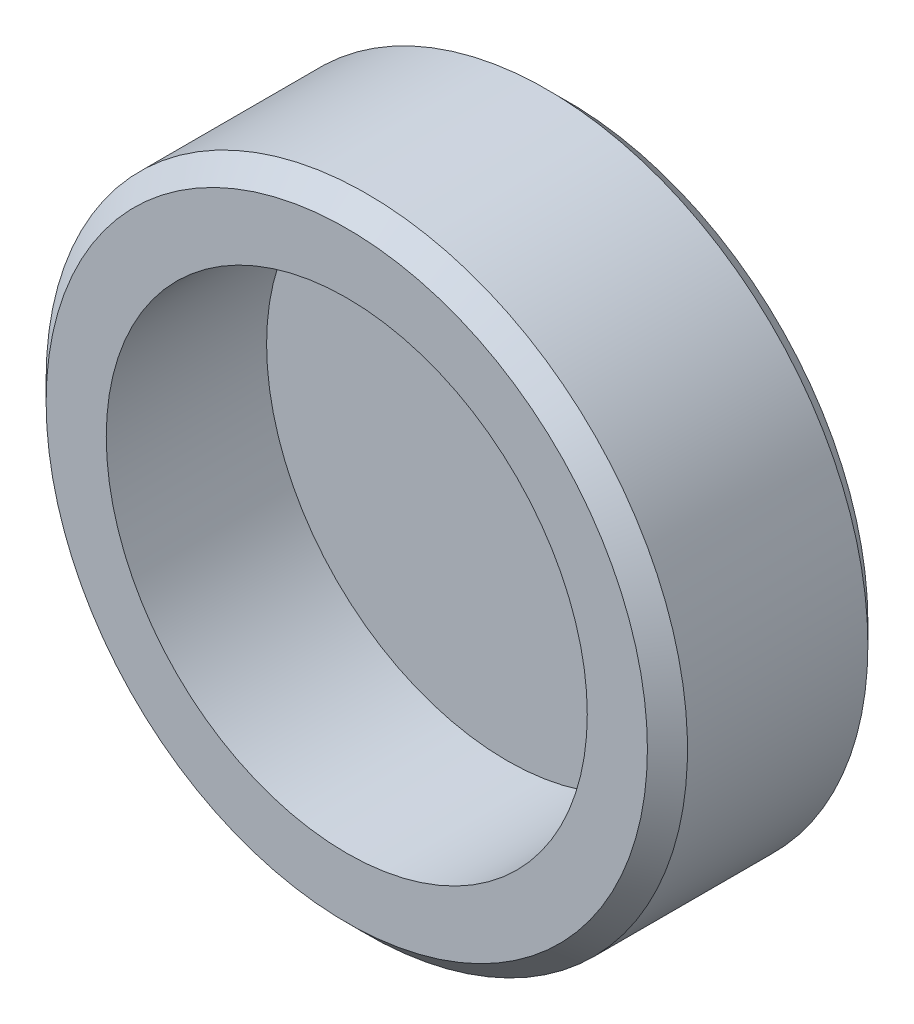
from build123d import *

# Parameters (mm, degrees)
SKETCH_1_R          = 16
EXTRUDE_1_DEPTH     = 11
CHAMFER_1_SIZE      = 1
SKETCH_2_R          = 12
CUT_EXTRUDE_1_DEPTH = 8


with BuildPart() as part:
    # 草图1 → 拉伸1 (new body)
    with BuildSketch(Plane.XY):
        Circle(SKETCH_1_R)
    extrude(amount=EXTRUDE_1_DEPTH)

    # 倒角1
    chamfer_1_edges = [part.edges().sort_by_distance(p)[0] for p in [
        (-16, 0, 0),
        (-16, 0, 11),
    ]]
    chamfer(chamfer_1_edges, length=CHAMFER_1_SIZE)

    # 草图2 → 切除-拉伸1 (cut)
    with BuildSketch(Plane.XY.offset(11)):
        Circle(SKETCH_2_R)
    extrude(amount=-CUT_EXTRUDE_1_DEPTH, mode=Mode.SUBTRACT)


solid = part.part
